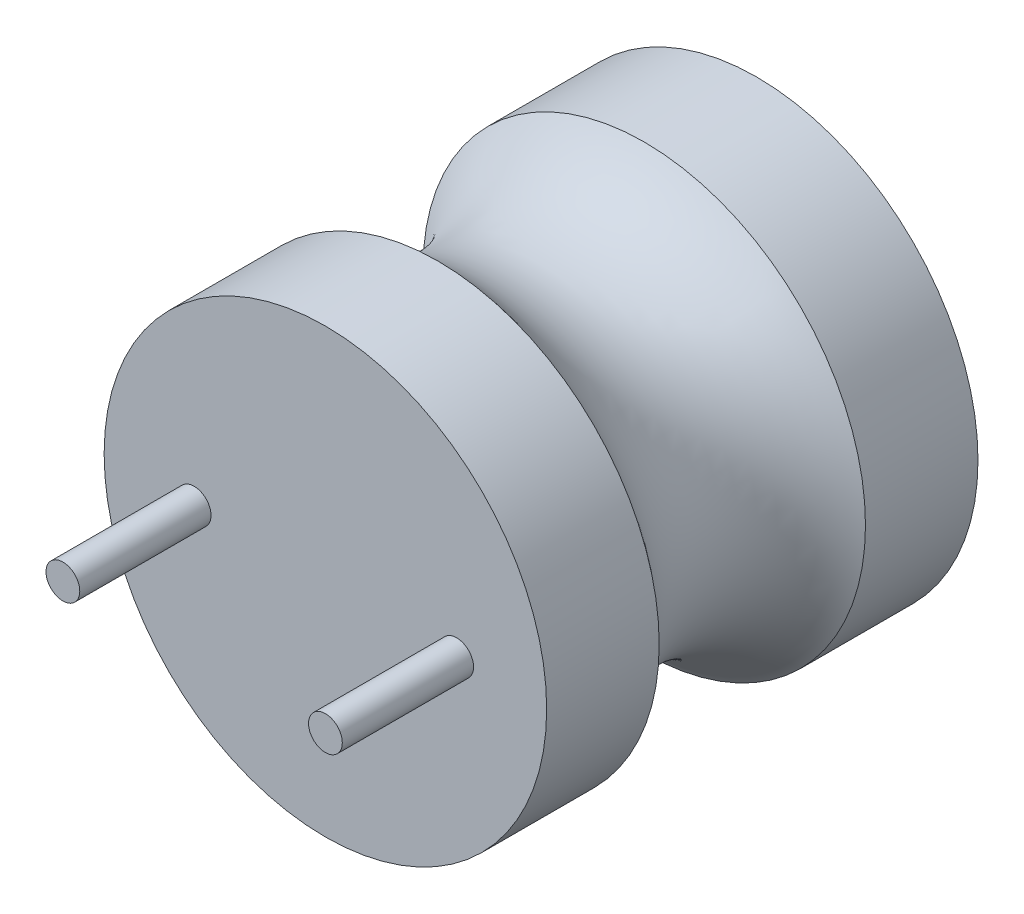
from build123d import *

# Parameters (mm, degrees)
SKETCH_2_R      = 0.45
EXTRUDE_1_DEPTH = 3.5


with BuildPart() as part:
    # Эскиз1 → Повернуть1 (revolve)
    with BuildSketch(Plane(origin=(0, 0, 0), x_dir=(1, 0, 0), z_dir=(0, 1, 0)), mode=Mode.PRIVATE) as revolve_1_sk:
        with BuildLine():
            Line((0, 0), (0, 11.5))
            Line((0, 11.5), (-5.9, 11.5))
            Line((-5.9, 11.5), (-5.9, 8.5))
            ThreePointArc((-5.9, 8.5), (-4.5, 5.75), (-5.9, 3))
            Line((-5.9, 3), (-5.9, 0))
            Line((-5.9, 0), (0, 0))
        make_face()
    revolve(revolve_1_sk.sketch.rotate(Axis((0, 0, 0), (0, 0, -1)), 180), axis=Axis((0, 0, 0), (0, 0, -1)))

    # Эскиз2 → Бобышка-Вытянуть1 (add)
    with BuildSketch(Plane.XY):
        with Locations(Location((-3.5, 0, 0), (0, 0, 180))):
            Circle(SKETCH_2_R)
        with Locations(Location((3.5, 0, 0), (0, 0, 180))):
            Circle(SKETCH_2_R)
    extrude(amount=EXTRUDE_1_DEPTH)


solid = part.part
